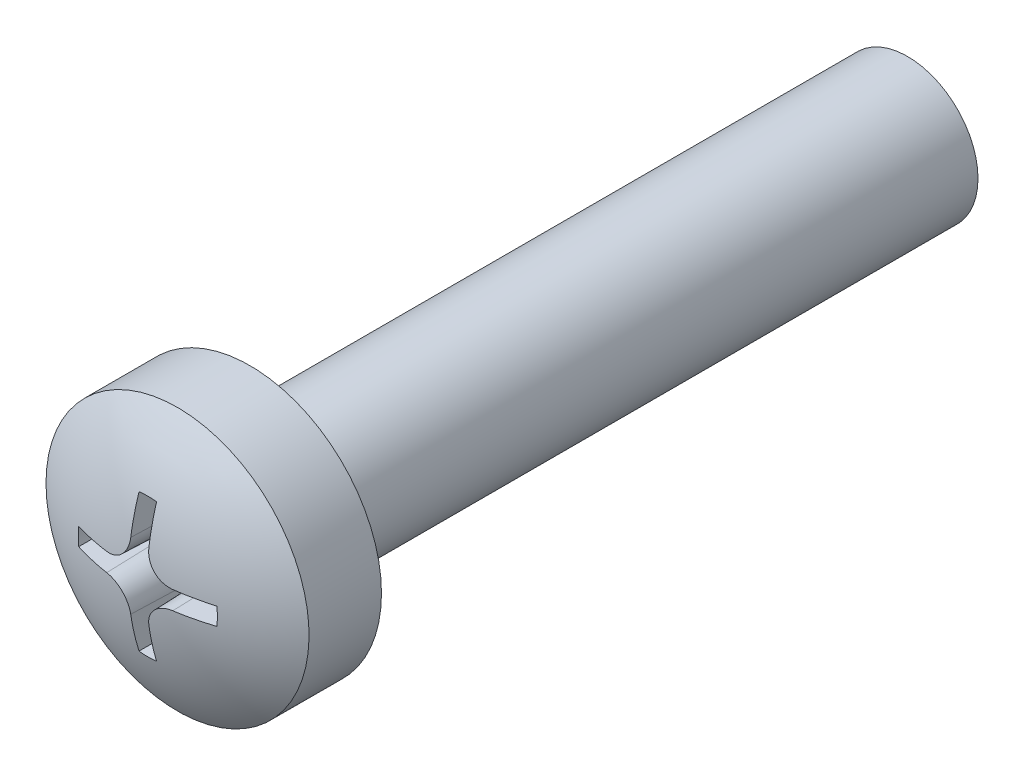
from build123d import *

# Parameters (mm, degrees)
SKETCH1_R          = 1.5
BASE_EXTRUDE_DEPTH = 14
CUT_EXTRUDE1_DEPTH = 1.799999969
CUT_EXTRUDE1_TAPER = 2


with BuildPart() as part:
    # Sketch1 → Base-Extrude (new body)
    with BuildSketch(Plane.XY):
        Circle(SKETCH1_R)
    extrude(amount=BASE_EXTRUDE_DEPTH)

    # Sketch6 → Boss-Revolve2 (revolve)
    with BuildSketch(Plane(origin=(0, 0, 0), x_dir=(1, 0, 0), z_dir=(0, 1, 0)), mode=Mode.PRIVATE) as boss_revolve2_sk:
        with BuildLine():
            Line((0, -14), (2.7999999, -14))
            Line((2.7999999, -14), (2.7999999, -15.54246308))
            ThreePointArc((2.7999999, -15.54246308), (1.46418655, -16.180811406), (0, -16.4))
            Line((0, -16.4), (0, -14))
        make_face()
    revolve(boss_revolve2_sk.sketch.rotate(Axis((0, 0, -0.393620135), (0, 0, 1)), 180), axis=Axis((0, 0, -0.393620135), (0, 0, 1)))

    # Sketch7 → Cut-Extrude1 (cut)
    with BuildSketch(Plane(origin=(0, 0, 16.7000001), x_dir=(-1, 0, 0), z_dir=(0, 0, -1))):
        with BuildLine():
            ThreePointArc((0.205000004, 1.48592565), (0, 1.500000013), (-0.205000004, 1.48592565))
            Line((-0.205000004, 1.48592565), (-0.205000004, 0.708178558))
            ThreePointArc((-0.205000004, 0.708178558), (-0.35072876, 0.355344481), (-0.702967546, 0.208182689))
            Line((-0.702967546, 0.208182689), (-1.48592565, 0.205000004))
            ThreePointArc((-1.48592565, 0.205000004), (-1.500000013, 0), (-1.48592565, -0.205000004))
            Line((-1.48592565, -0.205000004), (-0.702967546, -0.208182689))
            ThreePointArc((-0.702967546, -0.208182689), (-0.35072876, -0.355344481), (-0.205000004, -0.708178558))
            Line((-0.205000004, -0.708178558), (-0.205000004, -1.48592565))
            ThreePointArc((-0.205000004, -1.48592565), (0, -1.500000013), (0.205000004, -1.48592565))
            Line((0.205000004, -1.48592565), (0.205000004, -0.708178558))
            ThreePointArc((0.205000004, -0.708178558), (0.35072876, -0.355344481), (0.702967546, -0.208182689))
            Line((0.702967546, -0.208182689), (1.48592565, -0.205000004))
            ThreePointArc((1.48592565, -0.205000004), (1.500000013, 0), (1.48592565, 0.205000004))
            Line((1.48592565, 0.205000004), (0.702967546, 0.208182689))
            ThreePointArc((0.702967546, 0.208182689), (0.35072876, 0.355344481), (0.205000004, 0.708178558))
            Line((0.205000004, 0.708178558), (0.205000004, 1.48592565))
        make_face()
    extrude(amount=CUT_EXTRUDE1_DEPTH, taper=CUT_EXTRUDE1_TAPER, mode=Mode.SUBTRACT)


solid = part.part
